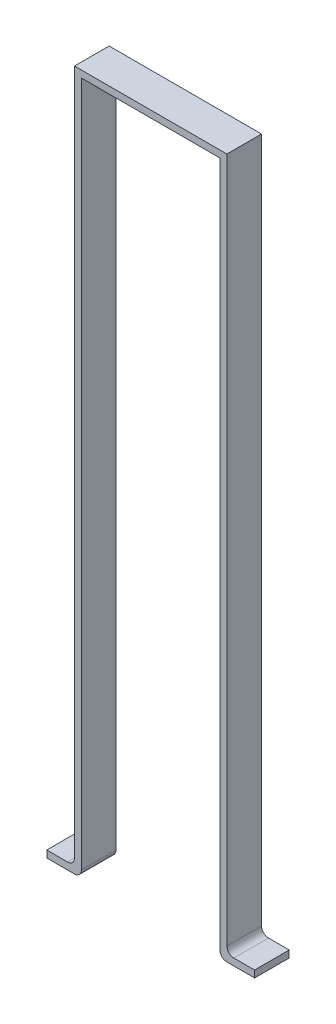
from build123d import *

# Parameters (mm, degrees)
BOSS_EXTRUDE1_DEPTH = 12.7


with BuildPart() as part:
    # Sketch1 → Boss-Extrude1 (new body)
    with BuildSketch(Plane.XY):
        with BuildLine():
            Line((-25.4, 2.54), (-25.4, 254))
            Line((-25.4, 254), (25.4, 254))
            Line((25.4, 254), (25.4, 2.54))
            ThreePointArc((25.4, 2.54), (26.143948776, 0.743948776), (27.94, 0))
            Line((27.94, 0), (38.1, 0))
            Line((38.1, 0), (38.1, 2.54))
            Line((38.1, 2.54), (30.48, 2.54))
            ThreePointArc((30.48, 2.54), (28.683948776, 3.283948776), (27.94, 5.08))
            Line((27.94, 5.08), (27.94, 256.54))
            Line((27.94, 256.54), (-27.94, 256.54))
            Line((-27.94, 256.54), (-27.94, 5.08))
            ThreePointArc((-27.94, 5.08), (-28.683948776, 3.283948776), (-30.48, 2.54))
            Line((-30.48, 2.54), (-38.1, 2.54))
            Line((-38.1, 2.54), (-38.1, 0))
            Line((-38.1, 0), (-27.94, 0))
            ThreePointArc((-27.94, 0), (-26.143948776, 0.743948776), (-25.4, 2.54))
        make_face()
    extrude(amount=BOSS_EXTRUDE1_DEPTH)


solid = part.part
